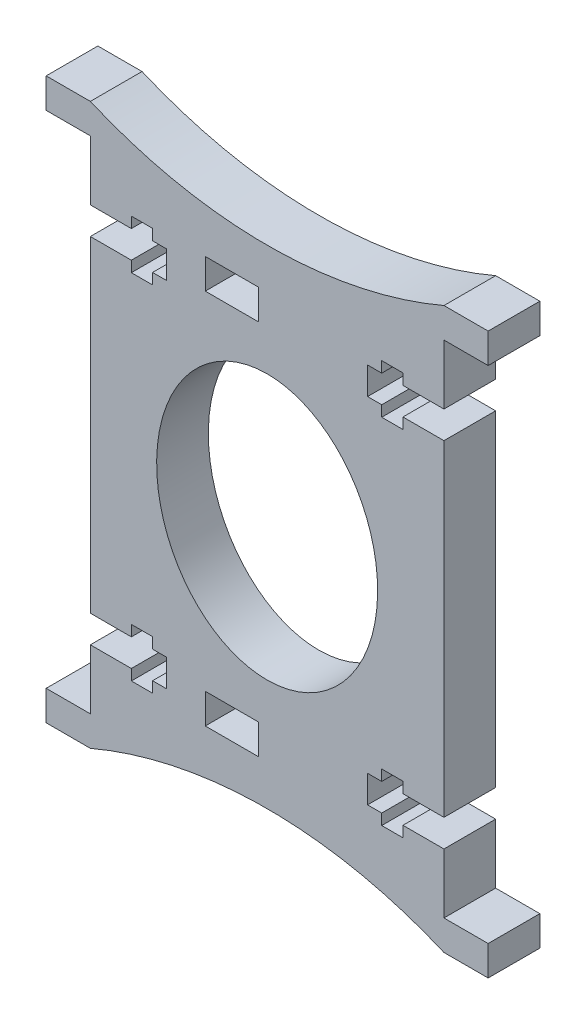
from build123d import *

# Parameters (mm, degrees)
SKETCH1_RX          = 15
SKETCH1_RY          = 12.5
SKETCH1_W           = 6
SKETCH1_H           = 3.4
BOSS_EXTRUDE1_DEPTH = 5.85


with BuildPart() as part:
    # Sketch1 → Boss-Extrude1 (new body)
    with BuildSketch(Plane.XY):
        with BuildLine():
            Line((12.961794972, -22.772242018), (15.361794972, -22.772242018))
            Line((15.361794972, -22.772242018), (15.361794972, -21.547840006))
            Line((15.361794972, -21.547840006), (20, -21.547840006))
            Line((20, -21.547840006), (20, -28.31))
            Line((20, -28.31), (25, -28.31))
            Line((25, -28.31), (25, -31.69))
            Line((25, -31.69), (20, -31.69))
            ThreePointArc((20, -31.69), (0, -27.6), (-20, -31.69))
            Line((-20, -31.69), (-25, -31.69))
            Line((-25, -31.69), (-25, -28.31))
            Line((-25, -28.31), (-20, -28.31))
            Line((-20, -28.31), (-20, -21.547840006))
            Line((-20, -21.547840006), (-15.361794972, -21.547840006))
            Line((-15.361794972, -21.547840006), (-15.361794972, -22.772242018))
            Line((-15.361794972, -22.772242018), (-12.961794972, -22.772242018))
            Line((-12.961794972, -22.772242018), (-12.961794972, -21.547840006))
            Line((-12.961794972, -21.547840006), (-11.361794972, -21.547840006))
            Line((-11.361794972, -21.547840006), (-11.361794972, -18.452159994))
            Line((-11.361794972, -18.452159994), (-12.961794972, -18.452159994))
            Line((-12.961794972, -18.452159994), (-12.961794972, -17.227757982))
            Line((-12.961794972, -17.227757982), (-15.361794972, -17.227757982))
            Line((-15.361794972, -17.227757982), (-15.361794972, -18.452159994))
            Line((-15.361794972, -18.452159994), (-20, -18.452159994))
            Line((-20, -18.452159994), (-20, 0))
            Line((-20, 0), (-20, 18.452159994))
            Line((-20, 18.452159994), (-15.361794972, 18.452159994))
            Line((-15.361794972, 18.452159994), (-15.361794972, 17.227757982))
            Line((-15.361794972, 17.227757982), (-12.961794972, 17.227757982))
            Line((-12.961794972, 17.227757982), (-12.961794972, 18.452159994))
            Line((-12.961794972, 18.452159994), (-11.361794972, 18.452159994))
            Line((-11.361794972, 18.452159994), (-11.361794972, 21.547840006))
            Line((-11.361794972, 21.547840006), (-12.961794972, 21.547840006))
            Line((-12.961794972, 21.547840006), (-12.961794972, 22.772242018))
            Line((-12.961794972, 22.772242018), (-15.361794972, 22.772242018))
            Line((-15.361794972, 22.772242018), (-15.361794972, 21.547840006))
            Line((-15.361794972, 21.547840006), (-20, 21.547840006))
            Line((-20, 21.547840006), (-20, 28.31))
            Line((-20, 28.31), (-25, 28.31))
            Line((-25, 28.31), (-25, 31.69))
            Line((-25, 31.69), (-20, 31.69))
            ThreePointArc((-20, 31.69), (0, 27.6), (20, 31.69))
            Line((20, 31.69), (25, 31.69))
            Line((25, 31.69), (25, 28.31))
            Line((25, 28.31), (20, 28.31))
            Line((20, 28.31), (20, 21.547840006))
            Line((20, 21.547840006), (15.361794972, 21.547840006))
            Line((15.361794972, 21.547840006), (15.361794972, 22.772242018))
            Line((15.361794972, 22.772242018), (12.961794972, 22.772242018))
            Line((12.961794972, 22.772242018), (12.961794972, 21.547840006))
            Line((12.961794972, 21.547840006), (11.361794972, 21.547840006))
            Line((11.361794972, 21.547840006), (11.361794972, 18.452159994))
            Line((11.361794972, 18.452159994), (12.961794972, 18.452159994))
            Line((12.961794972, 18.452159994), (12.961794972, 17.227757982))
            Line((12.961794972, 17.227757982), (15.361794972, 17.227757982))
            Line((15.361794972, 17.227757982), (15.361794972, 18.452159994))
            Line((15.361794972, 18.452159994), (20, 18.452159994))
            Line((20, 18.452159994), (20, 0))
            Line((20, 0), (20, -18.452159994))
            Line((20, -18.452159994), (15.361794972, -18.452159994))
            Line((15.361794972, -18.452159994), (15.361794972, -17.227757982))
            Line((15.361794972, -17.227757982), (12.961794972, -17.227757982))
            Line((12.961794972, -17.227757982), (12.961794972, -18.452159994))
            Line((12.961794972, -18.452159994), (11.361794972, -18.452159994))
            Line((11.361794972, -18.452159994), (11.361794972, -21.547840006))
            Line((11.361794972, -21.547840006), (12.961794972, -21.547840006))
            Line((12.961794972, -21.547840006), (12.961794972, -22.772242018))
        make_face()
        with Locations(Location((0, 0), (0, 0, 90))):
            Ellipse(SKETCH1_RX, SKETCH1_RY, mode=Mode.SUBTRACT)
        with Locations((-4, 21.3)):
            Rectangle(SKETCH1_W, SKETCH1_H, mode=Mode.SUBTRACT)
        with Locations((-4, -21.3)):
            Rectangle(SKETCH1_W, SKETCH1_H, mode=Mode.SUBTRACT)
    extrude(amount=BOSS_EXTRUDE1_DEPTH)


solid = part.part
